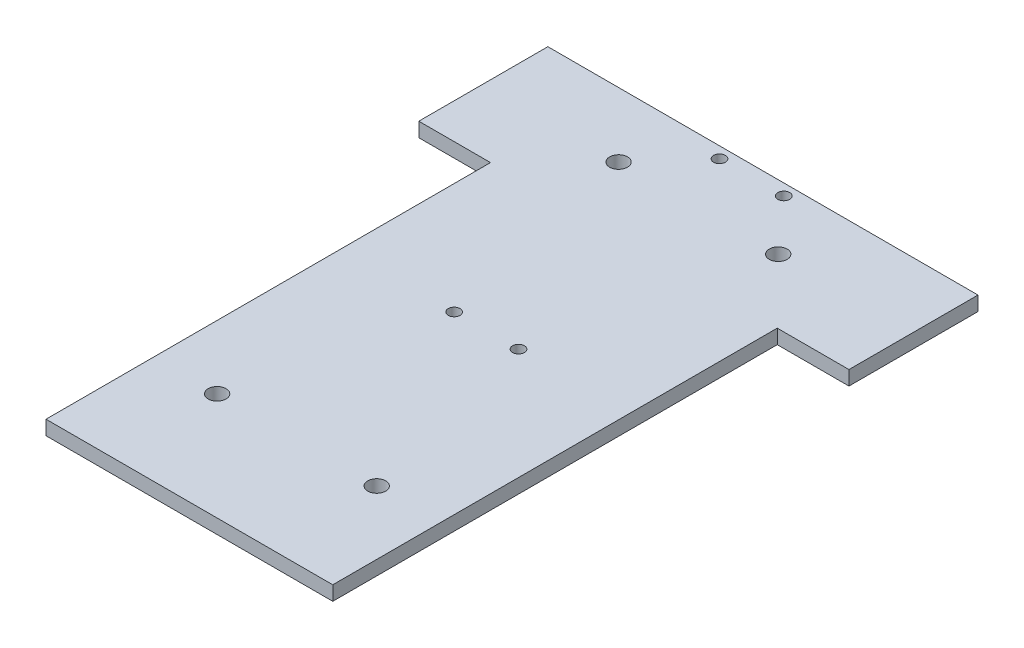
from build123d import *

# Parameters (mm, degrees)
BOSS_EXTRUDE1_DEPTH = 2.54
CUT_EXTRUDE1_REACH  = 129.025
SKETCH2_R           = 1.05
CUT_EXTRUDE2_REACH  = 129.025
SKETCH3_R           = 1.5875


with BuildPart() as part:
    # Sketch1 → Boss-Extrude1 (new body)
    with BuildSketch(Plane(origin=(0, 0, 0), x_dir=(1, 0, 0), z_dir=(0, 1, 0))):
        Polygon((0, 101.6), (76.2, 101.6), (76.2, 78.74), (63.5, 78.74), (63.5, 0), (12.7, 0), (12.7, 78.74), (0, 78.74), align=None)
    extrude(amount=BOSS_EXTRUDE1_DEPTH)

    # Sketch2 → Cut-Extrude1 (cut, up to next)
    with BuildSketch(Plane(origin=(0, 2.54, 0), x_dir=(1, 0, 0), z_dir=(0, 1, 0)), mode=Mode.PRIVATE) as cut_extrude1_sk1:
        with Locations(Location((32.4, 52.6, 0), (0, 0, 270))):
            Circle(SKETCH2_R)
    cut_extrude1_tool1 = extrude(cut_extrude1_sk1.sketch, amount=-CUT_EXTRUDE1_REACH, mode=Mode.PRIVATE) & part.part
    # Sketch2 → Cut-Extrude1 (cut, up to next)
    with BuildSketch(Plane(origin=(0, 2.54, 0), x_dir=(1, 0, 0), z_dir=(0, 1, 0)), mode=Mode.PRIVATE) as cut_extrude1_sk2:
        with Locations(Location((43.8, 52.6, 0), (0, 0, 270))):
            Circle(SKETCH2_R)
    cut_extrude1_tool2 = extrude(cut_extrude1_sk2.sketch, amount=-CUT_EXTRUDE1_REACH, mode=Mode.PRIVATE) & part.part
    # Sketch2 → Cut-Extrude1 (cut, up to next)
    with BuildSketch(Plane(origin=(0, 2.54, 0), x_dir=(1, 0, 0), z_dir=(0, 1, 0)), mode=Mode.PRIVATE) as cut_extrude1_sk3:
        with Locations(Location((43.8, 99.6, 0), (0, 0, 270))):
            Circle(SKETCH2_R)
    cut_extrude1_tool3 = extrude(cut_extrude1_sk3.sketch, amount=-CUT_EXTRUDE1_REACH, mode=Mode.PRIVATE) & part.part
    # Sketch2 → Cut-Extrude1 (cut, up to next)
    with BuildSketch(Plane(origin=(0, 2.54, 0), x_dir=(1, 0, 0), z_dir=(0, 1, 0)), mode=Mode.PRIVATE) as cut_extrude1_sk4:
        with Locations(Location((32.4, 99.6, 0), (0, 0, 270))):
            Circle(SKETCH2_R)
    cut_extrude1_tool4 = extrude(cut_extrude1_sk4.sketch, amount=-CUT_EXTRUDE1_REACH, mode=Mode.PRIVATE) & part.part
    add(cut_extrude1_tool1.solids().sort_by_distance((32.4, 2.54, -52.6))[0], mode=Mode.SUBTRACT)
    add(cut_extrude1_tool2.solids().sort_by_distance((43.8, 2.54, -52.6))[0], mode=Mode.SUBTRACT)
    add(cut_extrude1_tool3.solids().sort_by_distance((43.8, 2.54, -99.6))[0], mode=Mode.SUBTRACT)
    add(cut_extrude1_tool4.solids().sort_by_distance((32.4, 2.54, -99.6))[0], mode=Mode.SUBTRACT)

    # Sketch3 → Cut-Extrude2 (cut, up to next)
    with BuildSketch(Plane(origin=(0, 0, 0), x_dir=(-1, 0, 0), z_dir=(0, -1, 0)), mode=Mode.PRIVATE) as cut_extrude2_sk1:
        with Locations(Location((-23.962149238, 19.05, 0), (0, 0, 90))):
            Circle(SKETCH3_R)
    cut_extrude2_tool1 = extrude(cut_extrude2_sk1.sketch, amount=-CUT_EXTRUDE2_REACH, mode=Mode.PRIVATE) & part.part
    # Sketch3 → Cut-Extrude2 (cut, up to next)
    with BuildSketch(Plane(origin=(0, 0, 0), x_dir=(-1, 0, 0), z_dir=(0, -1, 0)), mode=Mode.PRIVATE) as cut_extrude2_sk2:
        with Locations(Location((-52.237850762, 19.05, 0), (0, 0, 90))):
            Circle(SKETCH3_R)
    cut_extrude2_tool2 = extrude(cut_extrude2_sk2.sketch, amount=-CUT_EXTRUDE2_REACH, mode=Mode.PRIVATE) & part.part
    # Sketch3 → Cut-Extrude2 (cut, up to next)
    with BuildSketch(Plane(origin=(0, 0, 0), x_dir=(-1, 0, 0), z_dir=(0, -1, 0)), mode=Mode.PRIVATE) as cut_extrude2_sk3:
        with Locations(Location((-23.962149238, 90.17, 0), (0, 0, 90))):
            Circle(SKETCH3_R)
    cut_extrude2_tool3 = extrude(cut_extrude2_sk3.sketch, amount=-CUT_EXTRUDE2_REACH, mode=Mode.PRIVATE) & part.part
    # Sketch3 → Cut-Extrude2 (cut, up to next)
    with BuildSketch(Plane(origin=(0, 0, 0), x_dir=(-1, 0, 0), z_dir=(0, -1, 0)), mode=Mode.PRIVATE) as cut_extrude2_sk4:
        with Locations(Location((-52.237850762, 90.17, 0), (0, 0, 90))):
            Circle(SKETCH3_R)
    cut_extrude2_tool4 = extrude(cut_extrude2_sk4.sketch, amount=-CUT_EXTRUDE2_REACH, mode=Mode.PRIVATE) & part.part
    add(cut_extrude2_tool1.solids().sort_by_distance((23.962149, 0, -19.05))[0], mode=Mode.SUBTRACT)
    add(cut_extrude2_tool2.solids().sort_by_distance((52.237851, 0, -19.05))[0], mode=Mode.SUBTRACT)
    add(cut_extrude2_tool3.solids().sort_by_distance((23.962149, 0, -90.17))[0], mode=Mode.SUBTRACT)
    add(cut_extrude2_tool4.solids().sort_by_distance((52.237851, 0, -90.17))[0], mode=Mode.SUBTRACT)


solid = part.part
